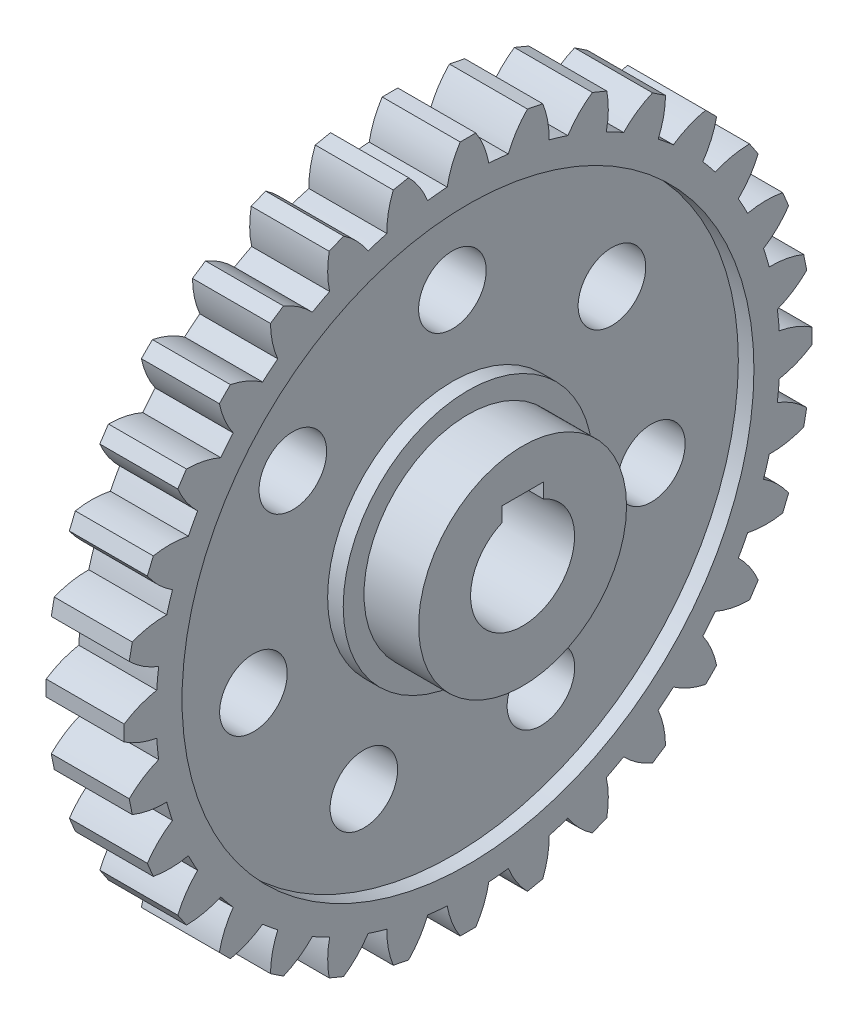
from build123d import *

# Parameters (mm, degrees)
SKETCH1_R           = 60
BOSS_EXTRUDE1_DEPTH = 7.5
BOSS_EXTRUDE2_DEPTH = 15
CIRPATTERN1_COUNT   = 32
SKETCH3_R           = 20
BOSS_EXTRUDE4_DEPTH = 18
CUT_EXTRUDE1_DEPTH  = 101.216188592
SKETCH6_R           = 55
SKETCH6_R_2         = 24
CUT_EXTRUDE2_DEPTH  = 3
SKETCH7_R           = 6.5
CUT_EXTRUDE3_DEPTH  = 97.195293315


with BuildPart() as part:
    # Sketch1 → Boss-Extrude1 (new, symmetric)
    with BuildSketch(Plane(origin=(0, 0, 0), x_dir=(0, 0, -1), z_dir=(1, 0, 0))):
        Circle(SKETCH1_R)
    extrude(amount=BOSS_EXTRUDE1_DEPTH, both=True)

    # Sketch2 → Boss-Extrude2 (add)
    with BuildSketch(Plane(origin=(7.5, 0, 0), x_dir=(0, 0, -1), z_dir=(1, 0, 0))):
        with BuildLine():
            Line((-1.5, 66.133518188), (1.5, 66.133518188))
            ThreePointArc((1.5, 66.133518188), (3.064041848, 63.125294177), (4, 59.866518188))
            ThreePointArc((4, 59.866518188), (0, 60), (-4, 59.866518188))
            ThreePointArc((-4, 59.866518188), (-3.064041848, 63.125294177), (-1.5, 66.133518188))
        make_face()
    boss_extrude2 = extrude(amount=-BOSS_EXTRUDE2_DEPTH)

    # CirPattern1: Boss-Extrude2 ×32 about axis
    cirpattern1_axis = Axis((0, 0, 0), (1, 0, 0))
    for i in range(1, CIRPATTERN1_COUNT):
        add(boss_extrude2.rotate(cirpattern1_axis, i * 360 / CIRPATTERN1_COUNT))

    # Sketch3 → Boss-Extrude4 (add, symmetric)
    with BuildSketch(Plane(origin=(0, 0, 0), x_dir=(0, 0, -1), z_dir=(1, 0, 0))):
        Circle(SKETCH3_R)
    extrude(amount=BOSS_EXTRUDE4_DEPTH, both=True)

    # Sketch5 → Cut-Extrude1 (cut, through all)
    with BuildSketch(Plane(origin=(18, 0, 0), x_dir=(0, 0, -1), z_dir=(1, 0, 0))):
        with BuildLine():
            Line((-4, 12), (4, 12))
            Line((4, 12), (4, 9.16515139))
            ThreePointArc((4, 9.16515139), (0, -10), (-4, 9.16515139))
            Line((-4, 9.16515139), (-4, 12))
        make_face()
    extrude(amount=-CUT_EXTRUDE1_DEPTH, mode=Mode.SUBTRACT)

    # Sketch6 → Cut-Extrude2 (cut)
    with BuildSketch(Plane(origin=(7.5, 0, 0), x_dir=(0, 0, -1), z_dir=(1, 0, 0))):
        Circle(SKETCH6_R)
        Circle(SKETCH6_R_2, mode=Mode.SUBTRACT)
    extrude(amount=-CUT_EXTRUDE2_DEPTH, mode=Mode.SUBTRACT)

    # Sketch7 → Cut-Extrude3 (cut, through all)
    with BuildSketch(Plane(origin=(4.5, 0, 0), x_dir=(0, 0, -1), z_dir=(1, 0, 0))):
        with Locations((0, 39.25)):
            Circle(SKETCH7_R)
        with Locations((30.686885687, 24.471974723)):
            Circle(SKETCH7_R)
        with Locations((38.265920553, -8.733946658)):
            Circle(SKETCH7_R)
        with Locations((17.02993676, -35.363028065)):
            Circle(SKETCH7_R)
        with Locations((-17.02993676, -35.363028065)):
            Circle(SKETCH7_R)
        with Locations((-38.265920553, -8.733946658)):
            Circle(SKETCH7_R)
        with Locations((-30.686885687, 24.471974723)):
            Circle(SKETCH7_R)
    extrude(amount=-CUT_EXTRUDE3_DEPTH, mode=Mode.SUBTRACT)


solid = part.part
